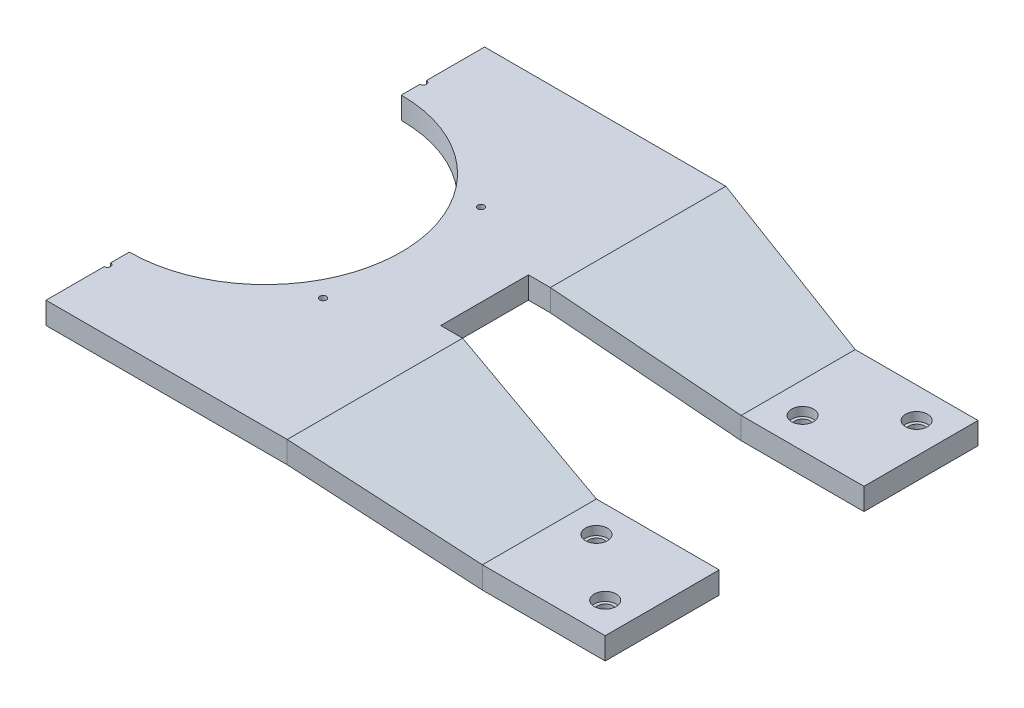
from build123d import *

# Parameters (mm, degrees)
SKETCH_1_W          = 28
SKETCH_1_H          = 26
EXTRUDE_1_DEPTH     = 5
EXTRUDE_1_2_DEPTH   = 5
EXTRUDE_START       = 10
SKETCH_1_12_W       = 50
SKETCH_1_12_H       = 100
EXTRUDE_2_DEPTH     = 5
SKETCH_2_W          = 40
SKETCH_2_H          = 5
EXTRUDE_3_DEPTH     = 5
SKETCH_3_R          = 1.8
CUT_EXTRUDE_1_DEPTH = 131.38404815
SKETCH_3_3_R        = 2.5
CUT_EXTRUDE_2_DEPTH = 2
SKETCH_4_R          = 0.75
CUT_EXTRUDE_3_DEPTH = 4
SKETCH_5_R          = 31
CUT_EXTRUDE_4_DEPTH = 131.862523333


with BuildPart() as part:
    # 草图1 → 凸台-拉伸1 (new body)
    with BuildSketch(Plane(origin=(0, 0, 0), x_dir=(1, 0, 0), z_dir=(0, 1, 0))):
        with Locations((106, 29.5)):
            Rectangle(SKETCH_1_W, SKETCH_1_H)
    extrude(amount=EXTRUDE_1_DEPTH)


with BuildPart() as body_2:
    # 草图1 → Extrude 1 2 (new body)
    with BuildSketch(Plane(origin=(0, 0, 0), x_dir=(1, 0, 0), z_dir=(0, 1, 0))):
        with Locations((106, -29.5)):
            Rectangle(SKETCH_1_W, SKETCH_1_H)
    extrude(amount=EXTRUDE_1_2_DEPTH)


with BuildPart() as body_3:
    # 草图1<12> → 凸台-拉伸2 (new body)
    with BuildSketch(Plane(origin=(0, 0, 0), x_dir=(1, 0, 0), z_dir=(0, 1, 0)).offset(EXTRUDE_START)):
        with Locations((25, 0)):
            Rectangle(SKETCH_1_12_W, SKETCH_1_12_H)
    extrude(amount=EXTRUDE_2_DEPTH)

    # 草图2 → 凸台-拉伸3 (add)
    with BuildSketch(Plane(origin=(50, 0, 0), x_dir=(0, 0, -1), z_dir=(1, 0, 0))):
        with Locations((30, 12.5)):
            Rectangle(SKETCH_2_W, SKETCH_2_H)
        with Locations((-30, 12.5)):
            Rectangle(SKETCH_2_W, SKETCH_2_H)
    extrude(amount=EXTRUDE_3_DEPTH)


    add(body_2.part)  # loft_5 joins it to this body
    # loft from a face of the part (loft_5)
    loft([body_3.faces().sort_by_distance((55, 12.5, 30))[0], body_3.faces().sort_by_distance((92, 2.5, 29.5))[0]])


    add(part.part)  # loft_6 joins it to this body
    # loft from a face of the part (loft_6)
    loft([body_3.faces().sort_by_distance((55, 12.5, -30))[0], body_3.faces().sort_by_distance((92, 2.5, -29.5))[0]])

    # 草图3 → 切除-拉伸1 (cut, through all)
    with BuildSketch(Plane(origin=(0, 5, 0), x_dir=(1, 0, 0), z_dir=(0, 1, 0))):
        with Locations(Location((113, 35.5, 0), (0, 0, 270))):
            Circle(SKETCH_3_R)
        with Locations(Location((99, 23.5, 0), (0, 0, 270))):
            Circle(SKETCH_3_R)
        with Locations(Location((113, -35.5, 0), (0, 0, 270))):
            Circle(SKETCH_3_R)
        with Locations(Location((99, -23.5, 0), (0, 0, 270))):
            Circle(SKETCH_3_R)
    extrude(amount=-CUT_EXTRUDE_1_DEPTH, mode=Mode.SUBTRACT)

    # 草图3<3> → 切除-拉伸2 (cut)
    with BuildSketch(Plane(origin=(0, 5, 0), x_dir=(1, 0, 0), z_dir=(0, 1, 0))):
        with Locations(Location((99, 23.5, 0), (0, 0, 270))):
            Circle(SKETCH_3_3_R)
        with Locations(Location((113, 35.5, 0), (0, 0, 270))):
            Circle(SKETCH_3_3_R)
        with Locations(Location((113, -35.5, 0), (0, 0, 270))):
            Circle(SKETCH_3_3_R)
        with Locations(Location((99, -23.5, 0), (0, 0, 270))):
            Circle(SKETCH_3_3_R)
    extrude(amount=-CUT_EXTRUDE_2_DEPTH, mode=Mode.SUBTRACT)

    # 草图4 → 切除-拉伸3 (cut)
    with BuildSketch(Plane(origin=(0, 15, 0), x_dir=(1, 0, 0), z_dir=(0, 1, 0))):
        with Locations((0, 36)):
            Circle(SKETCH_4_R)
        with Locations(Location((31.176914536, 18, 0), (0, 0, 270))):
            Circle(SKETCH_4_R)
        with Locations(Location((31.176914536, -18, 0), (0, 0, 270))):
            Circle(SKETCH_4_R)
        with Locations((0, -36)):
            Circle(SKETCH_4_R)
    extrude(amount=-CUT_EXTRUDE_3_DEPTH, mode=Mode.SUBTRACT)

    # 草图5 → 切除-拉伸4 (cut, through all)
    with BuildSketch(Plane(origin=(0, 15, 0), x_dir=(1, 0, 0), z_dir=(0, 1, 0))):
        Circle(SKETCH_5_R)
    extrude(amount=-CUT_EXTRUDE_4_DEPTH, mode=Mode.SUBTRACT)


solid = body_3.part
